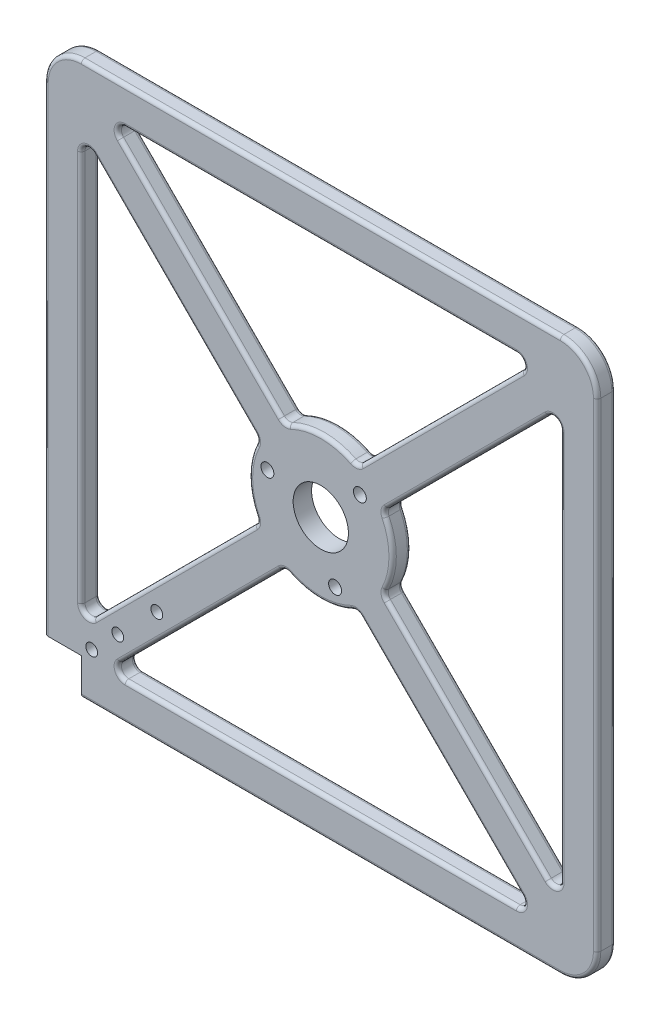
from build123d import *

# Parameters (mm, degrees)
SKETCH1_R               = 7.5
BOSS_EXTRUDE1_DEPTH     = 2.5
FILLET1_R               = 1
CUT_EXTRUDE3_DEPTH      = 107.183802908
CUT_EXTRUDE3_DEPTH_BACK = 107.183802908
SKETCH5_R               = 1.75
SKETCH6_W               = 10
SKETCH6_H               = 5
BOSS_EXTRUDE4_DEPTH     = 10
SKETCH7_W               = 5
SKETCH7_H               = 10
BOSS_EXTRUDE5_DEPTH     = 10
FILLET2_R               = 10
CUT_EXTRUDE4_DEPTH      = 107.183802913
CUT_EXTRUDE4_DEPTH_BACK = 107.183802913
SKETCH3_R               = 1.6
FILLET3_R               = 1


with BuildPart() as part:
    # Sketch1 → Boss-Extrude1 (new, symmetric)
    with BuildSketch(Plane.XY):
        Polygon((-75, -65), (-65, -65), (-65, -75), (65, -75), (65, -65), (75, -65), (75, 65), (65, 65), (65, 75), (-65, 75), (-65, 65), (-75, 65), align=None)
        Circle(SKETCH1_R, mode=Mode.SUBTRACT)
        with BuildLine():
            Line((-65, -53.100505063), (-65, 53.100505063))
            ThreePointArc((-65, 53.100505063), (-63.765366865, 54.948264128), (-61.585786438, 54.514718626))
            Line((-61.585786438, 54.514718626), (-17.909990417, 10.838922606))
            ThreePointArc((-17.909990417, 10.838922606), (-17.351635088, 9.754818067), (-17.52660361, 8.547991923))
            ThreePointArc((-17.52660361, 8.547991923), (-19.5, 0), (-17.52660361, -8.547991923))
            ThreePointArc((-17.52660361, -8.547991923), (-17.351635088, -9.754818067), (-17.909990417, -10.838922606))
            Line((-17.909990417, -10.838922606), (-61.585786438, -54.514718626))
            ThreePointArc((-61.585786438, -54.514718626), (-63.765366865, -54.948264128), (-65, -53.100505063))
        make_face(mode=Mode.SUBTRACT)
        with BuildLine():
            Line((53.100505063, 65), (-53.100505063, 65))
            ThreePointArc((-53.100505063, 65), (-54.948264128, 63.765366865), (-54.514718626, 61.585786438))
            Line((-54.514718626, 61.585786438), (-10.838922606, 17.909990417))
            ThreePointArc((-10.838922606, 17.909990417), (-9.754818067, 17.351635088), (-8.547991923, 17.52660361))
            ThreePointArc((-8.547991923, 17.52660361), (0, 19.5), (8.547991923, 17.52660361))
            ThreePointArc((8.547991923, 17.52660361), (9.754818067, 17.351635088), (10.838922606, 17.909990417))
            Line((10.838922606, 17.909990417), (54.514718626, 61.585786438))
            ThreePointArc((54.514718626, 61.585786438), (54.948264128, 63.765366865), (53.100505063, 65))
        make_face(mode=Mode.SUBTRACT)
        with BuildLine():
            Line((65, -53.100505063), (65, 53.100505063))
            ThreePointArc((65, 53.100505063), (63.765366865, 54.948264128), (61.585786438, 54.514718626))
            Line((61.585786438, 54.514718626), (17.909990417, 10.838922606))
            ThreePointArc((17.909990417, 10.838922606), (17.351635088, 9.754818067), (17.52660361, 8.547991923))
            ThreePointArc((17.52660361, 8.547991923), (19.5, 0), (17.52660361, -8.547991923))
            ThreePointArc((17.52660361, -8.547991923), (17.351635088, -9.754818067), (17.909990417, -10.838922606))
            Line((17.909990417, -10.838922606), (61.585786438, -54.514718626))
            ThreePointArc((61.585786438, -54.514718626), (63.765366865, -54.948264128), (65, -53.100505063))
        make_face(mode=Mode.SUBTRACT)
        with BuildLine():
            Line((53.100505063, -65), (-53.100505063, -65))
            ThreePointArc((-53.100505063, -65), (-54.948264128, -63.765366865), (-54.514718626, -61.585786438))
            Line((-54.514718626, -61.585786438), (-10.838922606, -17.909990417))
            ThreePointArc((-10.838922606, -17.909990417), (-9.754818067, -17.351635088), (-8.547991923, -17.52660361))
            ThreePointArc((-8.547991923, -17.52660361), (0, -19.5), (8.547991923, -17.52660361))
            ThreePointArc((8.547991923, -17.52660361), (9.754818067, -17.351635088), (10.838922606, -17.909990417))
            Line((10.838922606, -17.909990417), (54.514718626, -61.585786438))
            ThreePointArc((54.514718626, -61.585786438), (54.948264128, -63.765366865), (53.100505063, -65))
        make_face(mode=Mode.SUBTRACT)
    extrude(amount=BOSS_EXTRUDE1_DEPTH, both=True)

    # Fillet1
    fillet1_edges = [part.edges().sort_by_distance(p)[0] for p in [
        (-63.765366865, -54.948264128, -2.5),
        (-39.747888428, -32.676820616, -2.5),
        (-17.351635088, -9.754818067, -2.5),
        (-19.5, 0, -2.5),
        (-17.351635088, 9.754818067, -2.5),
        (-39.747888428, 32.676820616, -2.5),
        (-63.765366865, 54.948264128, -2.5),
        (-65, 0, -2.5),
        (-63.765366865, -54.948264128, 2.5),
        (-39.747888428, -32.676820616, 2.5),
        (-17.351635088, -9.754818067, 2.5),
        (-19.5, 0, 2.5),
        (-17.351635088, 9.754818067, 2.5),
        (-39.747888428, 32.676820616, 2.5),
        (-63.765366865, 54.948264128, 2.5),
        (-65, 0, 2.5),
        (9.754818067, 17.351635088, -2.5),
        (32.676820616, 39.747888428, -2.5),
        (54.948264128, 63.765366865, -2.5),
        (0, 65, -2.5),
        (-54.948264128, 63.765366865, -2.5),
        (-32.676820616, 39.747888428, -2.5),
        (-9.754818067, 17.351635088, -2.5),
        (0, 19.5, -2.5),
        (9.754818067, 17.351635088, 2.5),
        (32.676820616, 39.747888428, 2.5),
        (54.948264128, 63.765366865, 2.5),
        (0, 65, 2.5),
        (-54.948264128, 63.765366865, 2.5),
        (-32.676820616, 39.747888428, 2.5),
        (-9.754818067, 17.351635088, 2.5),
        (0, 19.5, 2.5),
        (63.765366865, -54.948264128, -2.5),
        (65, 0, -2.5),
        (63.765366865, 54.948264128, -2.5),
        (39.747888428, 32.676820616, -2.5),
        (17.351635088, 9.754818067, -2.5),
        (19.5, 0, -2.5),
        (17.351635088, -9.754818067, -2.5),
        (39.747888428, -32.676820616, -2.5),
        (63.765366865, -54.948264128, 2.5),
        (65, 0, 2.5),
        (63.765366865, 54.948264128, 2.5),
        (39.747888428, 32.676820616, 2.5),
        (17.351635088, 9.754818067, 2.5),
        (19.5, 0, 2.5),
        (17.351635088, -9.754818067, 2.5),
        (39.747888428, -32.676820616, 2.5),
        (-9.754818067, -17.351635088, -2.5),
        (-32.676820616, -39.747888428, -2.5),
        (-54.948264128, -63.765366865, -2.5),
        (0, -65, -2.5),
        (54.948264128, -63.765366865, -2.5),
        (32.676820616, -39.747888428, -2.5),
        (9.754818067, -17.351635088, -2.5),
        (0, -19.5, -2.5),
        (-9.754818067, -17.351635088, 2.5),
        (-32.676820616, -39.747888428, 2.5),
        (-54.948264128, -63.765366865, 2.5),
        (0, -65, 2.5),
        (54.948264128, -63.765366865, 2.5),
        (32.676820616, -39.747888428, 2.5),
        (9.754818067, -17.351635088, 2.5),
        (0, -19.5, 2.5),
    ]]
    fillet(fillet1_edges, radius=FILLET1_R)

    # Sketch5 → Cut-Extrude3 (cut, two sides: drawn at the far end of the back side and taken through both)
    with BuildSketch(Plane.XY.offset(2.5).offset(-CUT_EXTRUDE3_DEPTH_BACK)):
        with Locations((10.606601718, 10.606601718)):
            Circle(SKETCH5_R)
        with Locations((3.882285677, -14.488887394)):
            Circle(SKETCH5_R)
        with Locations((-14.488887394, 3.882285677)):
            Circle(SKETCH5_R)
    extrude(amount=CUT_EXTRUDE3_DEPTH + CUT_EXTRUDE3_DEPTH_BACK, mode=Mode.SUBTRACT)

    # Sketch6 → Boss-Extrude4 (add)
    with BuildSketch(Plane(origin=(0, 65, 0), x_dir=(1, 0, 0), z_dir=(0, 1, 0))):
        with Locations((70, 0)):
            Rectangle(SKETCH6_W, SKETCH6_H)
        with Locations((-70, 0)):
            Rectangle(SKETCH6_W, SKETCH6_H)
    extrude(amount=BOSS_EXTRUDE4_DEPTH)

    # Sketch7 → Boss-Extrude5 (add)
    with BuildSketch(Plane(origin=(65, 0, 0), x_dir=(0, 0, -1), z_dir=(1, 0, 0))):
        with Locations((0, -70)):
            Rectangle(SKETCH7_W, SKETCH7_H)
    extrude(amount=BOSS_EXTRUDE5_DEPTH)

    # Fillet2
    fillet2_edges = [part.edges().sort_by_distance(p)[0] for p in [
        (75, 75, 0),
        (-75, 75, 0),
        (75, -75, 0),
    ]]
    fillet(fillet2_edges, radius=FILLET2_R)

    # Sketch3 → Cut-Extrude4 (cut, two sides: drawn at the far end of the back side and taken through both)
    with BuildSketch(Plane(origin=(0, 0, -2.5), x_dir=(-1, 0, 0), z_dir=(0, 0, -1)).offset(-CUT_EXTRUDE4_DEPTH_BACK)):
        with Locations((44.493903346, -44.493903346)):
            Circle(SKETCH3_R)
        with Locations((62.171572875, -62.171572875)):
            Circle(SKETCH3_R)
        with Locations((55.100505063, -55.100505063)):
            Circle(SKETCH3_R)
    extrude(amount=CUT_EXTRUDE4_DEPTH + CUT_EXTRUDE4_DEPTH_BACK, mode=Mode.SUBTRACT)

    # Fillet3
    fillet3_edges = [part.edges().sort_by_distance(p)[0] for p in [
        (0, -75, -2.5),
        (0, -75, 2.5),
        (-75, 0, -2.5),
        (-75, 0, 2.5),
        (0, 75, -2.5),
        (75, 0, -2.5),
        (72.071067812, 72.071067812, -2.5),
        (72.071067812, -72.071067812, -2.5),
        (-72.071067812, 72.071067812, -2.5),
        (0, 75, 2.5),
        (75, 0, 2.5),
        (72.071067812, 72.071067812, 2.5),
        (72.071067812, -72.071067812, 2.5),
        (-72.071067812, 72.071067812, 2.5),
    ]]
    fillet(fillet3_edges, radius=FILLET3_R)


solid = part.part
